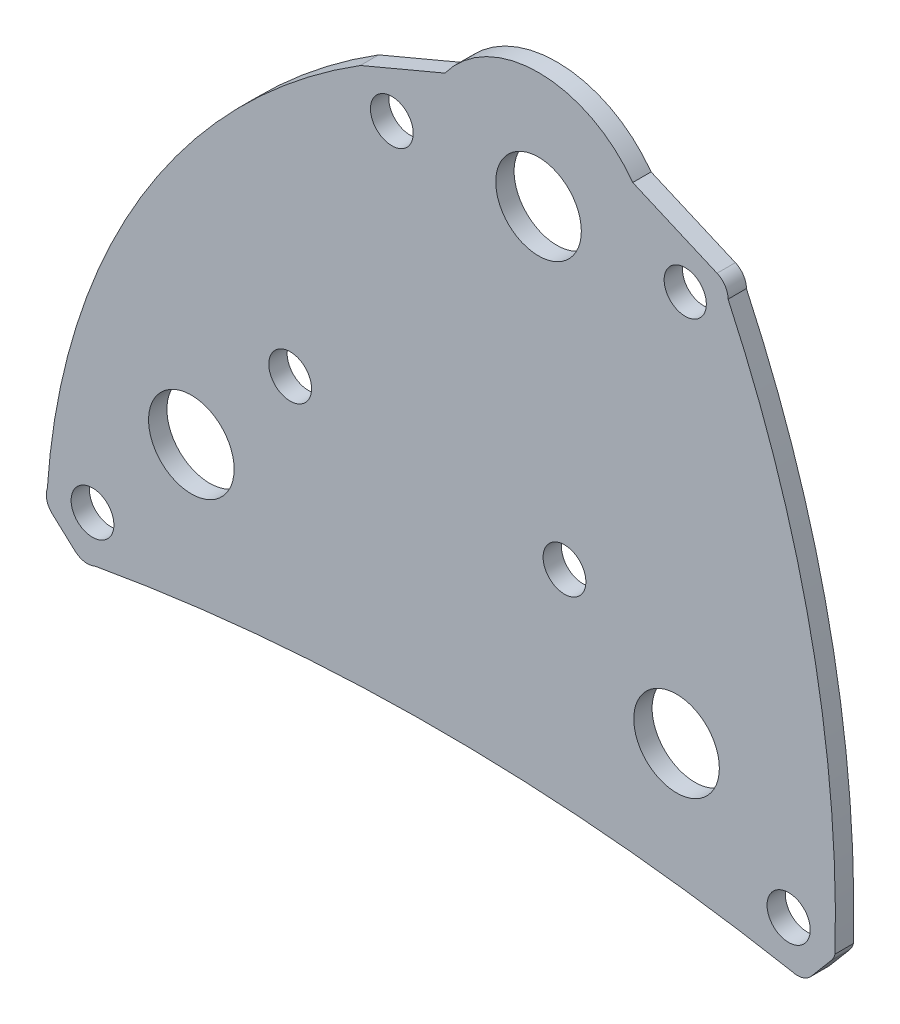
from build123d import *

# Parameters (mm, degrees)
SKETCH1_W           = 130
SKETCH1_H           = 110
BOSS_EXTRUDE1_DEPTH = 3
SKETCH2_W           = 130
SKETCH2_H           = 110
CUT_EXTRUDE1_DEPTH  = 10
SKETCH3_R           = 7
SKETCH3_R_2         = 3.451349814
SKETCH3_R_3         = 3.5
SKETCH3_R_4         = 3.533852352
CUT_EXTRUDE2_DEPTH  = 10


with BuildPart() as part:
    # Sketch1 → Boss-Extrude1 (new body)
    with BuildSketch(Plane.XY):
        Rectangle(SKETCH1_W, SKETCH1_H)
    extrude(amount=BOSS_EXTRUDE1_DEPTH)

    # Sketch2 → Cut-Extrude1 (cut)
    with BuildSketch(Plane.XY.offset(3)):
        Rectangle(SKETCH2_W, SKETCH2_H)
        with BuildLine():
            Line((-59.47576544, -53.607140846), (-63.198422227, -50.212423413))
            ThreePointArc((-63.198422227, -50.212423413), (-64.085317487, -48.731662044), (-64.00947903, -47.007282166))
            ThreePointArc((-64.00947903, -47.007282166), (-48.705948363, 1.925420221), (-12.800867901, 38.52367989))
            Line((-12.800867901, 38.52367989), (1.038853263, 44.361019449))
            ThreePointArc((1.038853263, 44.361019449), (16.438302804, 52.115303468), (31.767912546, 44.223850371))
            Line((31.767912546, 44.223850371), (45.554969528, 38.263189769))
            ThreePointArc((45.554969528, 38.263189769), (46.875270988, 37.151415741), (47.364426614, 35.496132017))
            ThreePointArc((47.364426614, 35.496132017), (60.992088303, -5.514592593), (64.85831391, -48.556955395))
            ThreePointArc((64.85831391, -48.556955395), (64.618469123, -49.190526824), (64.242583482, -49.754129754))
            Line((64.242583482, -49.754129754), (60.991812848, -53.603125765))
            ThreePointArc((60.991812848, -53.603125765), (59.545831313, -54.545662148), (57.819814936, -54.535420134))
            ThreePointArc((57.819814936, -54.535420134), (0.823909158, -49.163408252), (-56.209622322, -54.120027458))
            ThreePointArc((-56.209622322, -54.120027458), (-57.919722192, -54.354112628), (-59.47576544, -53.607140846))
        make_face(mode=Mode.SUBTRACT)
    extrude(amount=-CUT_EXTRUDE1_DEPTH, mode=Mode.SUBTRACT)

    # Sketch3 → Cut-Extrude2 (cut)
    with BuildSketch(Plane.XY.offset(3)):
        with Locations((16.353491015, 33.115492759)):
            Circle(SKETCH3_R)
        with Locations((40.35325191, 33.008362077)):
            Circle(SKETCH3_R_2)
        with Locations((-7.64626988, 33.222623441)):
            Circle(SKETCH3_R_3)
        with Locations((-40.448942317, -29.003775794)):
            Circle(SKETCH3_R)
        with Locations((-56.620414459, -46.737458118)):
            Circle(SKETCH3_R_3)
        with Locations((-24.277470176, -11.27009347)):
            Circle(SKETCH3_R_3)
        with Locations((20.598283056, -16.190449825)):
            Circle(SKETCH3_R_3)
        with Locations((38.933809649, -31.676200197)):
            Circle(SKETCH3_R)
        with Locations((57.269336242, -47.161950568)):
            Circle(SKETCH3_R_4)
    extrude(amount=-CUT_EXTRUDE2_DEPTH, mode=Mode.SUBTRACT)


solid = part.part
